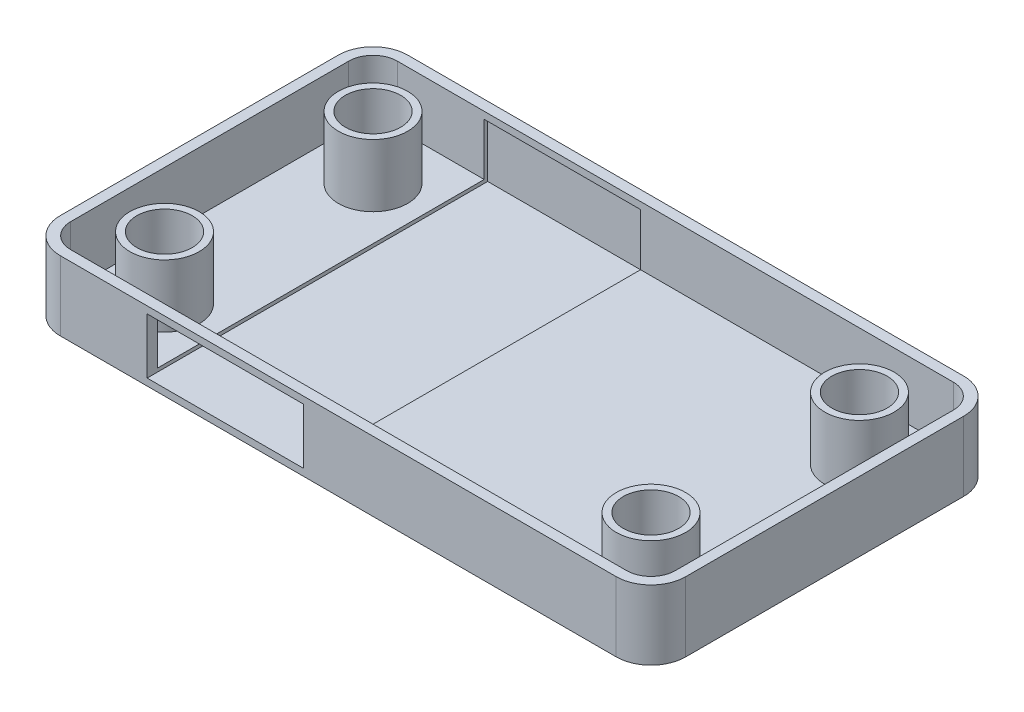
from build123d import *

# Parameters (mm, degrees)
BOSS_EXTRUDE1_DEPTH = 20
SHELL1_T            = -3
SKETCH3_R           = 9.972851257
SKETCH3_R_2         = 7.972851257
BOSS_EXTRUDE2_DEPTH = 18
SKETCH4_W           = 45
SKETCH4_H           = 16
CUT_EXTRUDE2_DEPTH  = 98


with BuildPart() as part:
    # Sketch1 → Boss-Extrude1 (new body)
    with BuildSketch(Plane(origin=(0, 0, 0), x_dir=(1, 0, 0), z_dir=(0, 1, 0))):
        with BuildLine():
            Line((-80, -50), (80, -50))
            ThreePointArc((80, -50), (87.071067812, -47.071067812), (90, -40))
            Line((90, -40), (90, 40))
            ThreePointArc((90, 40), (87.071067812, 47.071067812), (80, 50))
            Line((80, 50), (-80, 50))
            ThreePointArc((-80, 50), (-87.071067812, 47.071067812), (-90, 40))
            Line((-90, 40), (-90, -40))
            ThreePointArc((-90, -40), (-87.071067812, -47.071067812), (-80, -50))
        make_face()
    extrude(amount=BOSS_EXTRUDE1_DEPTH)

    # Shell1
    shell1_openings = [part.faces().sort_by_distance(p)[0] for p in [
        (0, 20, 0),
    ]]
    offset(amount=SHELL1_T, openings=shell1_openings, kind=Kind.INTERSECTION)

    # Sketch3 → Boss-Extrude2 (add)
    # profile 1 of 4: a face of its own
    with BuildSketch(Plane(origin=(0, 3, 0), x_dir=(1, 0, 0), z_dir=(0, 1, 0))):
        with Locations(Location((-70, 30, 0), (0, 0, 90))):
            Circle(SKETCH3_R)
        with Locations(Location((-70, 30, 0), (0, 0, 270))):
            Circle(SKETCH3_R_2, mode=Mode.SUBTRACT)
    # profile 2 of 4: a face of its own
    with BuildSketch(Plane(origin=(0, 3, 0), x_dir=(1, 0, 0), z_dir=(0, 1, 0))):
        with Locations(Location((70, 30, 0), (0, 0, 90))):
            Circle(SKETCH3_R)
        with Locations(Location((70, 30, 0), (0, 0, 90))):
            Circle(SKETCH3_R_2, mode=Mode.SUBTRACT)
    # profile 3 of 4: a face of its own
    with BuildSketch(Plane(origin=(0, 3, 0), x_dir=(1, 0, 0), z_dir=(0, 1, 0))):
        with Locations(Location((70, -30, 0), (0, 0, 90))):
            Circle(SKETCH3_R)
        with Locations(Location((70, -30, 0), (0, 0, 270))):
            Circle(SKETCH3_R_2, mode=Mode.SUBTRACT)
    # profile 4 of 4: a face of its own
    with BuildSketch(Plane(origin=(0, 3, 0), x_dir=(1, 0, 0), z_dir=(0, 1, 0))):
        with Locations(Location((-70, -30, 0), (0, 0, 90))):
            Circle(SKETCH3_R)
        with Locations(Location((-70, -30, 0), (0, 0, 90))):
            Circle(SKETCH3_R_2, mode=Mode.SUBTRACT)
    extrude(amount=BOSS_EXTRUDE2_DEPTH)

    # Sketch4 → Cut-Extrude2 (cut)
    with BuildSketch(Plane.XY.offset(50)):
        with Locations((-32.5, 10)):
            Rectangle(SKETCH4_W, SKETCH4_H)
    extrude(amount=-CUT_EXTRUDE2_DEPTH, mode=Mode.SUBTRACT)


solid = part.part
